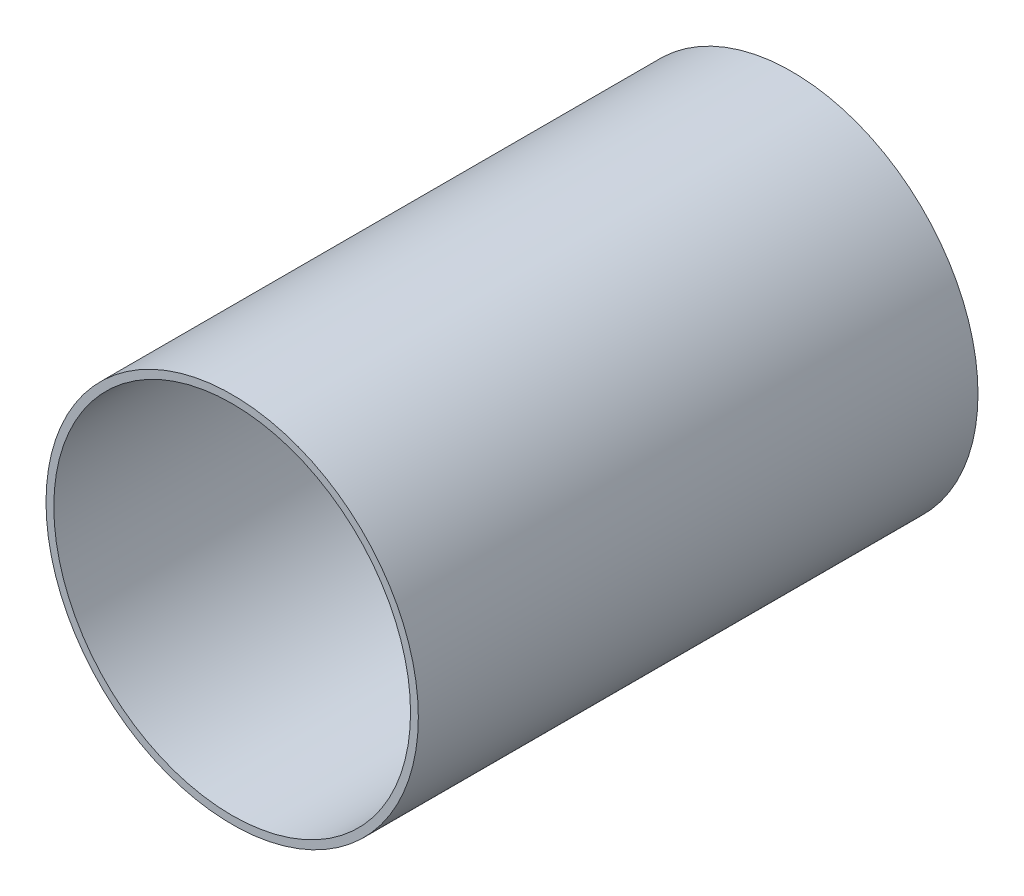
from build123d import *

# Parameters (mm, degrees)
BOSS_EXTRUDE1_DEPTH      = 80
BOSS_EXTRUDE1_DEPTH_BACK = 63.5
SKETCH1_R                = 47.734416477
SKETCH1_R_2              = 45.734416477


with BuildPart() as part:
    # Sketch1 → Boss-Extrude1 (new, two sides: drawn at the far end of the back side and taken through both)
    with BuildSketch(Plane.XY.offset(-BOSS_EXTRUDE1_DEPTH_BACK)):
        with Locations(Location((0, 0, 0), (0, 0, 180))):
            Circle(SKETCH1_R)
        with Locations(Location((0, 0, 0), (0, 0, 180))):
            Circle(SKETCH1_R_2, mode=Mode.SUBTRACT)
    extrude(amount=BOSS_EXTRUDE1_DEPTH + BOSS_EXTRUDE1_DEPTH_BACK)


solid = part.part
